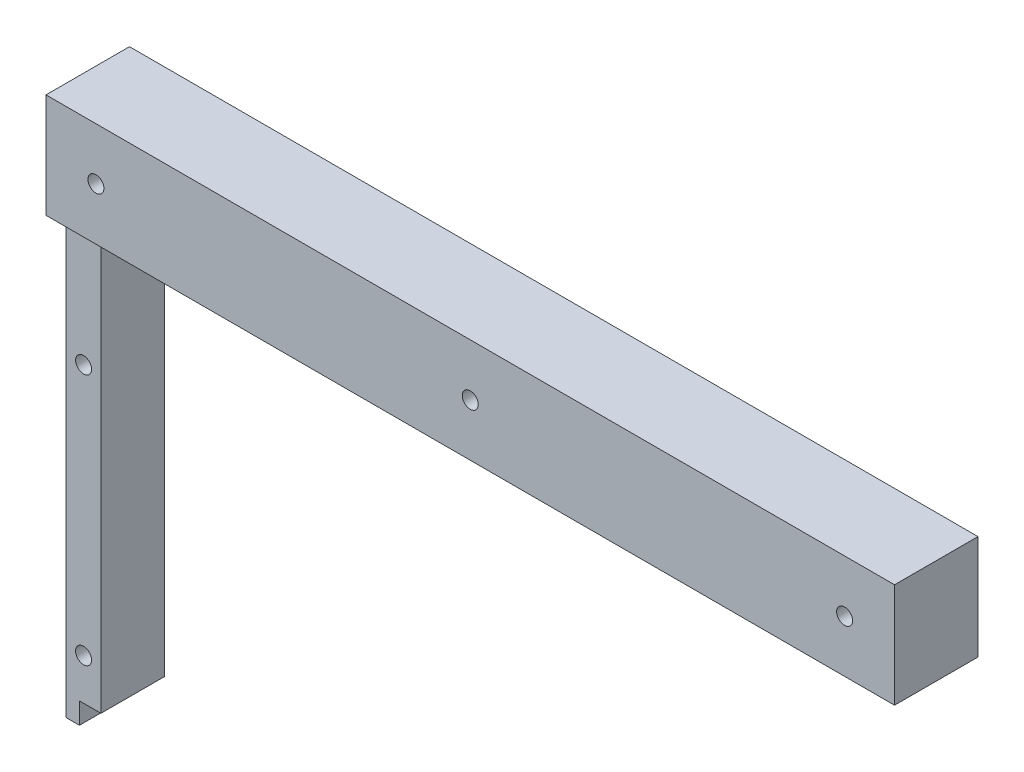
from build123d import *

# Parameters (mm, degrees)
SZKIC1_W                    = 48.766356044
SZKIC1_H                    = 9.435580599
DODANIE_WYCI_GNI_CIE1_DEPTH = 10
SZKIC2_W                    = 48.766356044
SZKIC2_H                    = 9.435580599
DODANIE_WYCI_GNI_CIE2_DEPTH = 2
SZKIC5_W                    = 12
SZKIC5_H                    = 9.435580599
DODANIE_WYCI_GNI_CIE3_DEPTH = 73.233643957
SZKIC6_W                    = 122
SZKIC6_H                    = 12
DODANIE_WYCI_GNI_CIE4_DEPTH = 5.564419
SZKIC7_W                    = 3.404574644
SZKIC7_H                    = 12
DODANIE_WYCI_GNI_CIE5_DEPTH = 64
SZKIC8_W                    = 12
SZKIC8_H                    = 3.048992282
WYTNIJ_WYCI_GNI_CIE1_DEPTH  = 1.5
SZKIC9_R                    = 1.15
WYTNIJ_WYCI_GNI_CIE2_DEPTH  = 130.048184814
SZKIC10_W                   = 12
SZKIC10_H                   = 60.951007718
DODANIE_WYCI_GNI_CIE6_DEPTH = 1.6
SZKIC11_R                   = 1.15
WYTNIJ_WYCI_GNI_CIE3_DEPTH  = 130.048184814
WYTNIJ_WYCI_GNI_CIE4_REACH  = 136.855
SZKIC12_W                   = 2.9
SZKIC12_H                   = 64


with BuildPart() as part:
    # Szkic1 → Dodanie-wyciągnięcie1 (new body)
    with BuildSketch(Plane.XY):
        with Locations((-17.932561551, 12.523716149)):
            Rectangle(SZKIC1_W, SZKIC1_H)
    extrude(amount=DODANIE_WYCI_GNI_CIE1_DEPTH)

    # Szkic2 → Dodanie-wyciągnięcie2 (add)
    with BuildSketch(Plane.XY.offset(10)):
        with Locations((-17.932561551, 12.523716149)):
            Rectangle(SZKIC2_W, SZKIC2_H)
    extrude(amount=DODANIE_WYCI_GNI_CIE2_DEPTH)

    # Szkic5 → Dodanie-wyciągnięcie3 (add)
    with BuildSketch(Plane.ZY.offset(42.315739573)):
        with Locations((6, 12.523716149)):
            Rectangle(SZKIC5_W, SZKIC5_H)
    extrude(amount=DODANIE_WYCI_GNI_CIE3_DEPTH)

    # Szkic6 → Dodanie-wyciągnięcie4 (add)
    with BuildSketch(Plane(origin=(0, 17.241506448, 0), x_dir=(1, 0, 0), z_dir=(0, 1, 0))):
        with Locations((-54.549383529, -6)):
            Rectangle(SZKIC6_W, SZKIC6_H)
    extrude(amount=DODANIE_WYCI_GNI_CIE4_DEPTH)

    # Szkic7 → Dodanie-wyciągnięcie5 (add)
    with BuildSketch(Plane.XZ.offset(-7.805925849)):
        with Locations((-113.847096207, 6)):
            Rectangle(SZKIC7_W, SZKIC7_H)
    extrude(amount=DODANIE_WYCI_GNI_CIE5_DEPTH)

    # Szkic8 → Wytnij-wyciągnięcie1 (cut)
    with BuildSketch(Plane(origin=(-112.144808885, 0, 0), x_dir=(0, 0, -1), z_dir=(1, 0, 0))):
        with Locations((-6, -54.66957801)):
            Rectangle(SZKIC8_W, SZKIC8_H)
    extrude(amount=-WYTNIJ_WYCI_GNI_CIE1_DEPTH, mode=Mode.SUBTRACT)

    # Szkic9 → Wytnij-wyciągnięcie2 (cut, through all)
    with BuildSketch(Plane.XY.offset(12)):
        with Locations((-54.549383529, 15.305925849)):
            Circle(SZKIC9_R)
        with Locations((-108.373957188, 15.305925849)):
            Circle(SZKIC9_R)
        with Locations(Location((-0.724809871, 15.305925849, 0), (0, 0, 180))):
            Circle(SZKIC9_R)
    extrude(amount=-WYTNIJ_WYCI_GNI_CIE2_DEPTH, mode=Mode.SUBTRACT)

    # Szkic10 → Dodanie-wyciągnięcie6 (add)
    with BuildSketch(Plane(origin=(-112.144808885, 0, 0), x_dir=(0, 0, -1), z_dir=(1, 0, 0))):
        with Locations((-6, -22.66957801)):
            Rectangle(SZKIC10_W, SZKIC10_H)
    extrude(amount=DODANIE_WYCI_GNI_CIE6_DEPTH)

    # Szkic11 → Wytnij-wyciągnięcie3 (cut, through all)
    with BuildSketch(Plane.XY.offset(12)):
        with Locations((-113.047096207, -47.199394186)):
            Circle(SZKIC11_R)
        with Locations((-113.047096207, -10.996775314)):
            Circle(SZKIC11_R)
    extrude(amount=-WYTNIJ_WYCI_GNI_CIE3_DEPTH, mode=Mode.SUBTRACT)

    # Wytnij-wyciągnięcie4: up to this face of the body (flat: up to its plane)
    wytnij_wyci_gni_cie4_end = Plane(part.part.faces().sort_by_distance((-110.544808885, -22.66957801, 6))[0])
    # Szkic12 → Wytnij-wyciągnięcie4 (cut, up to the picked face)
    with BuildSketch(Plane.ZY.offset(115.549383529), mode=Mode.PRIVATE) as wytnij_wyci_gni_cie4_sk1:
        with Locations((10.55, -24.194074151)):
            Rectangle(SZKIC12_W, SZKIC12_H)
    wytnij_wyci_gni_cie4_tool1 = split(extrude(wytnij_wyci_gni_cie4_sk1.sketch, amount=-WYTNIJ_WYCI_GNI_CIE4_REACH, mode=Mode.PRIVATE), bisect_by=wytnij_wyci_gni_cie4_end, keep=Keep.BOTH, mode=Mode.PRIVATE)
    add(wytnij_wyci_gni_cie4_tool1.solids().sort_by(Axis((-115.549384, -24.194074, 10.55), (1, 0, 0)))[0], mode=Mode.SUBTRACT)


solid = part.part
